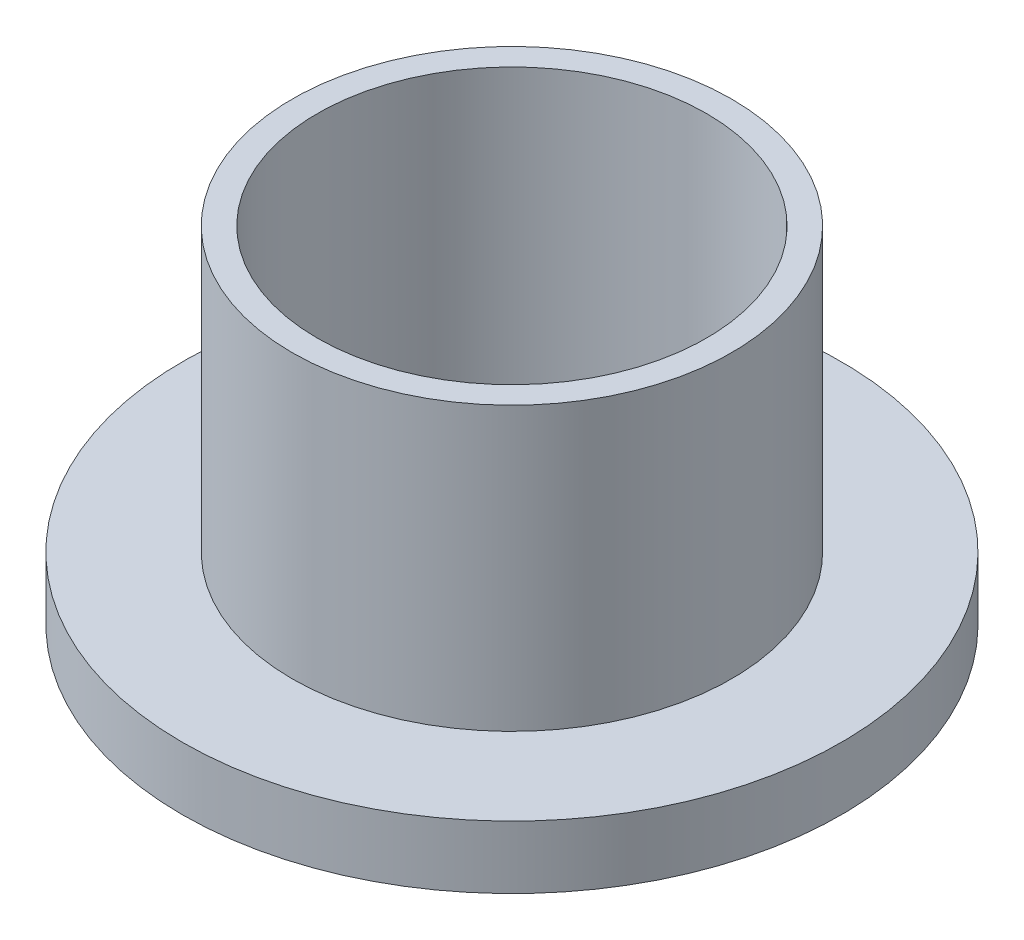
from build123d import *

# Parameters (mm, degrees)
SKETCH1_R           = 5.25
BOSS_EXTRUDE1_DEPTH = 1
SKETCH2_R           = 2.5
CUT_EXTRUDE1_DEPTH  = 1
SKETCH3_R           = 3.5
SKETCH3_R_2         = 3.1
BOSS_EXTRUDE2_DEPTH = 4.5


with BuildPart() as part:
    # Sketch1 → Boss-Extrude1 (new body)
    with BuildSketch(Plane(origin=(0, 0, 0), x_dir=(1, 0, 0), z_dir=(0, 1, 0))):
        with Locations(Location((0, 0, 0), (0, 0, 270))):
            Circle(SKETCH1_R)
    extrude(amount=BOSS_EXTRUDE1_DEPTH)

    # Sketch2 → Cut-Extrude1 (cut)
    with BuildSketch(Plane(origin=(0, 1, 0), x_dir=(1, 0, 0), z_dir=(0, 1, 0))):
        with Locations(Location((0, 0, 0), (0, 0, 270))):
            Circle(SKETCH2_R)
    extrude(amount=-CUT_EXTRUDE1_DEPTH, mode=Mode.SUBTRACT)

    # Sketch3 → Boss-Extrude2 (add)
    with BuildSketch(Plane(origin=(0, 1, 0), x_dir=(1, 0, 0), z_dir=(0, 1, 0))):
        with Locations(Location((0, 0, 0), (0, 0, 270))):
            Circle(SKETCH3_R)
        with Locations(Location((0, 0, 0), (0, 0, 270))):
            Circle(SKETCH3_R_2, mode=Mode.SUBTRACT)
    extrude(amount=BOSS_EXTRUDE2_DEPTH)


solid = part.part
